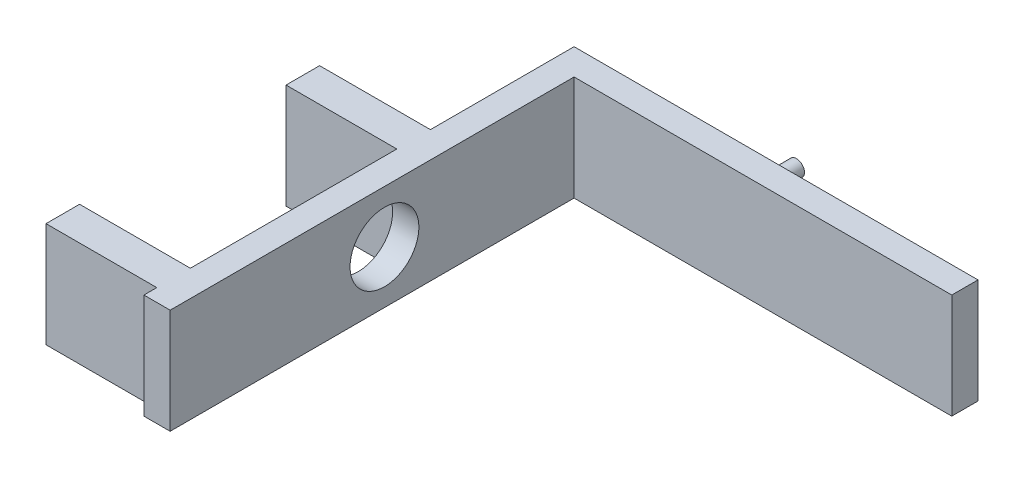
from build123d import *

# Parameters (mm, degrees)
BOSS_EXTRUDE1_DEPTH = 7.9375
SKETCH3_R           = 5.207
CUT_EXTRUDE1_DEPTH  = 3.96875
SKETCH4_R           = 1.2065
BOSS_EXTRUDE2_DEPTH = 8.89
SKETCH5_W           = 5.08
SKETCH5_H           = 15.875
BOSS_EXTRUDE3_DEPTH = 16.764
SKETCH6_R           = 1.143
CUT_EXTRUDE2_DEPTH  = 12.7


with BuildPart() as part:
    # Sketch1 → Boss-Extrude1 (new, symmetric)
    with BuildSketch(Plane(origin=(0, 0, 0), x_dir=(1, 0, 0), z_dir=(0, 1, 0))):
        Polygon((-2.757708096, -19.86108723), (1.211041904, -19.86108723), (1.211041904, 41.25766277), (58.361041904, 41.25766277), (58.361041904, 45.22641277), (6.27967861, 45.22641277), (-2.757708096, 45.22641277), align=None)
    extrude(amount=BOSS_EXTRUDE1_DEPTH, both=True)

    # Sketch3 → Cut-Extrude1 (cut)
    with BuildSketch(Plane.ZY.offset(2.757708096)):
        with Locations((-12.566559842, 0)):
            Circle(SKETCH3_R)
    extrude(amount=-CUT_EXTRUDE1_DEPTH, mode=Mode.SUBTRACT)

    # Sketch4 → Boss-Extrude2 (add)
    with BuildSketch(Plane(origin=(0, 0, -45.22641277), x_dir=(-1, 0, 0), z_dir=(0, 0, -1))):
        with Locations(Location((-22.007291904, 0, 0), (0, 0, 180))):
            Circle(SKETCH4_R)
    extrude(amount=BOSS_EXTRUDE2_DEPTH)

    # Sketch5 → Boss-Extrude3 (add)
    with BuildSketch(Plane.ZY.offset(2.757708096)):
        with Locations((-20.948559842, 0)):
            Rectangle(SKETCH5_W, SKETCH5_H)
        with Locations((15.373440158, 0)):
            Rectangle(SKETCH5_W, SKETCH5_H)
    extrude(amount=BOSS_EXTRUDE3_DEPTH)

    # Sketch6 → Cut-Extrude2 (cut)
    with BuildSketch(Plane.ZY.offset(19.521708096)):
        with Locations((14.855640158, 0)):
            Circle(SKETCH6_R)
        with Locations((-21.034559842, 0)):
            Circle(SKETCH6_R)
    extrude(amount=-CUT_EXTRUDE2_DEPTH, mode=Mode.SUBTRACT)


solid = part.part
